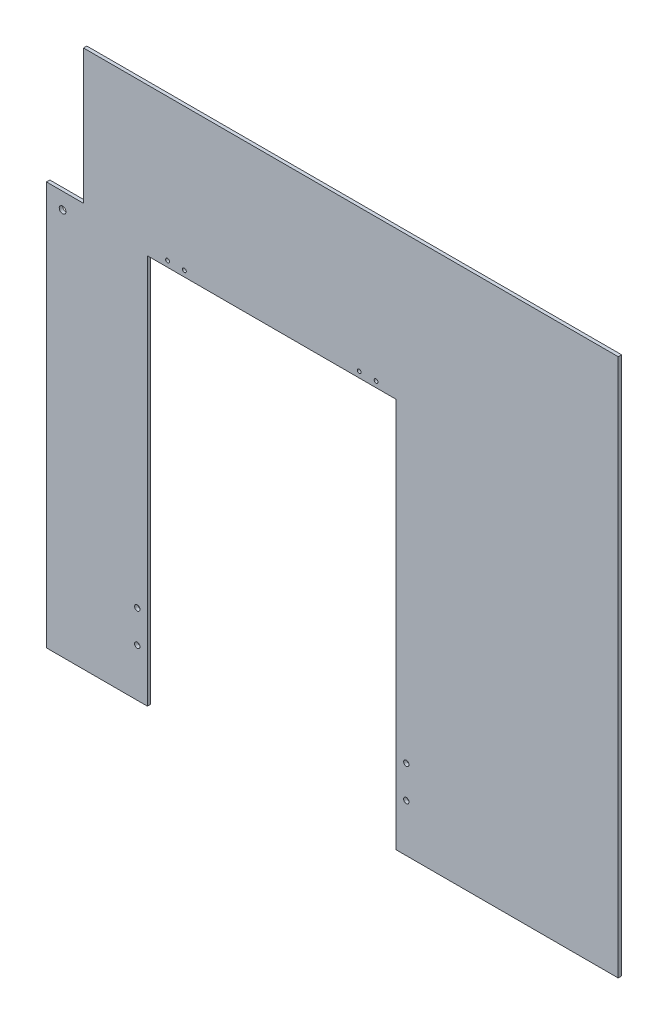
from build123d import *

# Parameters (mm, degrees)
SKETCH1_W           = 539.75
SKETCH1_H           = 508
BOSS_EXTRUDE1_DEPTH = 3.175
SKETCH2_R           = 2.54
SKETCH2_R_2         = 3.175
SKETCH2_W           = 234.95
SKETCH2_H           = 368.3
CUT_EXTRUDE1_DEPTH  = 44.45
SKETCH3_W           = 34.925
SKETCH3_H           = 127
CUT_EXTRUDE2_DEPTH  = 742.218013222
SKETCH4_R           = 1.8034
CUT_EXTRUDE3_DEPTH  = 742.218013222


with BuildPart() as part:
    # Sketch1 → Boss-Extrude1 (new body)
    with BuildSketch(Plane.XY):
        with Locations((269.875, 254)):
            Rectangle(SKETCH1_W, SKETCH1_H)
    extrude(amount=BOSS_EXTRUDE1_DEPTH)

    # Sketch2 → Cut-Extrude1 (cut)
    with BuildSketch(Plane(origin=(0, 0, 0), x_dir=(-1, 0, 0), z_dir=(0, 0, -1))):
        with Locations((-339.725, 45.085)):
            Circle(SKETCH2_R)
        with Locations((-85.725, 45.085)):
            Circle(SKETCH2_R)
        with Locations((-15.24, 365.76)):
            Circle(SKETCH2_R_2)
        with Locations((-339.725, 75.565)):
            Circle(SKETCH2_R)
        with Locations((-85.725, 75.565)):
            Circle(SKETCH2_R)
        with Locations((-212.725, 184.15)):
            Rectangle(SKETCH2_W, SKETCH2_H)
    extrude(amount=-CUT_EXTRUDE1_DEPTH, mode=Mode.SUBTRACT)

    # Sketch3 → Cut-Extrude2 (cut, through all)
    with BuildSketch(Plane(origin=(0, 0, 0), x_dir=(-1, 0, 0), z_dir=(0, 0, -1))):
        with Locations((-17.4625, 444.5)):
            Rectangle(SKETCH3_W, SKETCH3_H)
    extrude(amount=-CUT_EXTRUDE2_DEPTH, mode=Mode.SUBTRACT)

    # Sketch4 → Cut-Extrude3 (cut, through all)
    with BuildSketch(Plane(origin=(0, 0, 0), x_dir=(-1, 0, 0), z_dir=(0, 0, -1))):
        with Locations((-311.1754, 373.8372)):
            Circle(SKETCH4_R)
        with Locations((-295.3004, 373.8372)):
            Circle(SKETCH4_R)
        with Locations((-130.2004, 373.8372)):
            Circle(SKETCH4_R)
        with Locations((-114.3254, 373.8372)):
            Circle(SKETCH4_R)
    extrude(amount=-CUT_EXTRUDE3_DEPTH, mode=Mode.SUBTRACT)


solid = part.part
